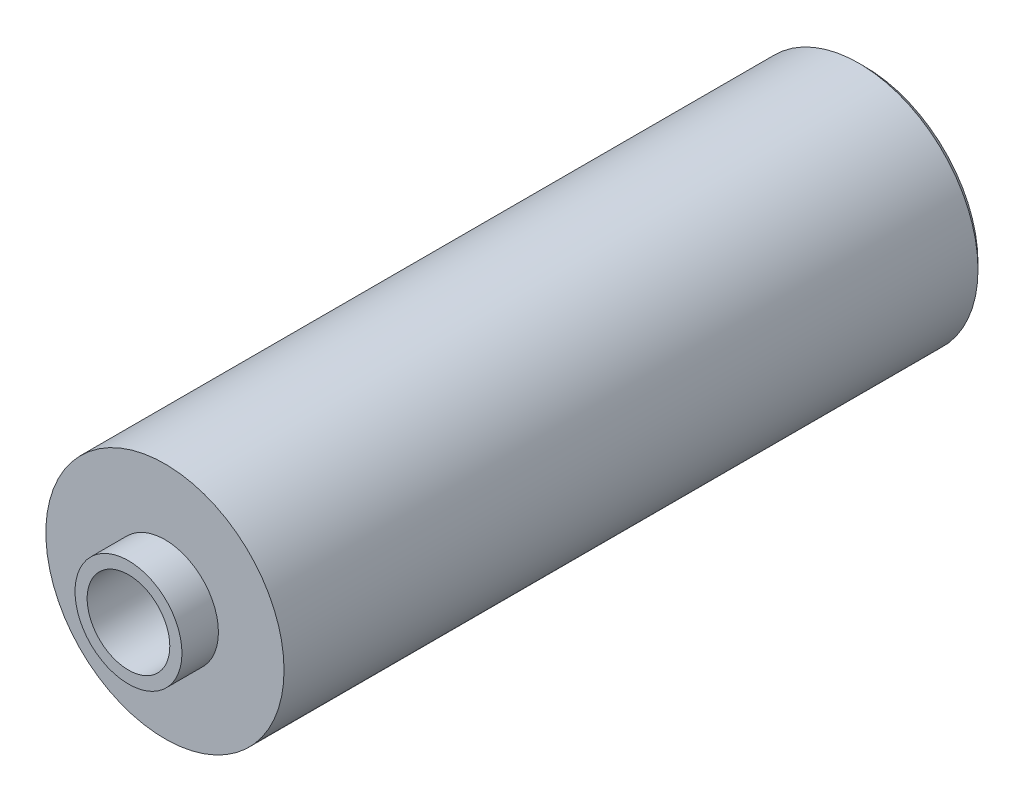
from build123d import *

# Parameters (mm, degrees)
SKETCH1_R           = 4.9
SKETCH1_R_2         = 1.7
BOSS_EXTRUDE1_DEPTH = 28.8
SKETCH2_R           = 2.2
SKETCH2_R_2         = 1.7
BOSS_EXTRUDE2_DEPTH = 1.5
CHAMFER1_SIZE       = 0.25


with BuildPart() as part:
    # Sketch1 → Boss-Extrude1 (new body)
    with BuildSketch(Plane.XY):
        Circle(SKETCH1_R)
        Circle(SKETCH1_R_2, mode=Mode.SUBTRACT)
    extrude(amount=BOSS_EXTRUDE1_DEPTH)

    # Sketch2 → Boss-Extrude2 (add)
    with BuildSketch(Plane.XY.offset(28.8)):
        Circle(SKETCH2_R)
        Circle(SKETCH2_R_2, mode=Mode.SUBTRACT)
    extrude(amount=BOSS_EXTRUDE2_DEPTH)

    # Chamfer1
    chamfer1_edges = [part.edges().sort_by_distance(p)[0] for p in [
        (-4.9, 0, 0),
        (-1.7, 0, 0),
    ]]
    chamfer(chamfer1_edges, length=CHAMFER1_SIZE)


solid = part.part
